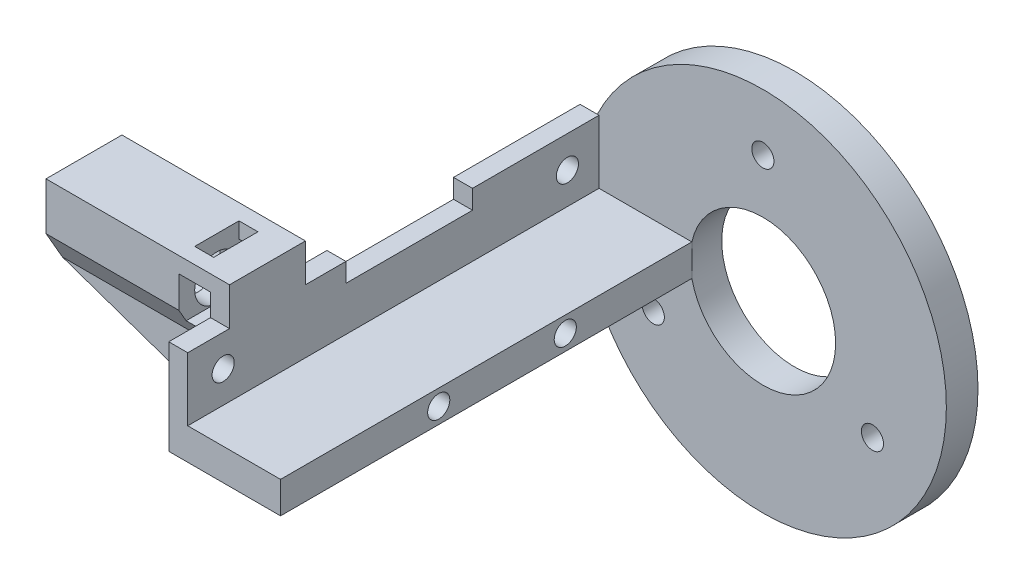
from build123d import *

# Parameters (mm, degrees)
SKETCH_1_R               = 29
EXTRUDE_1_DEPTH          = 5
HOLE_WIZARD_1_D          = 3.5
HOLE_WIZARD_2_D          = 23
EXTRUDE_3_DEPTH          = 65
SKETCH_9_W               = 1
SKETCH_9_H               = 5
CUT_EXTRUDE_1_DEPTH      = 10
SKETCH_10_W              = 3
SKETCH_10_H              = 65
EXTRUDE_5_DEPTH          = 10
HOLE_WIZARD_3_D          = 3.5
CUT_EXTRUDE_2_REACH      = 97.355
SKETCH_16_W              = 20
SKETCH_16_H              = 3
EXTRUDE_START            = -65
EXTRUDE_6_DEPTH          = 65
HOLE_WIZARD_4_D          = 3.5
SKETCH_22_W              = 12
SKETCH_22_H              = 6
EXTRUDE_7_DEPTH          = 3
EXTRUDE_8_DEPTH          = 8
HOLE_WIZARD_5_D          = 7
HOLE_WIZARD_5_DEPTH      = 3
SKETCH_27_W              = 5
SKETCH_27_H              = 3.5
CUT_EXTRUDE_3_DEPTH      = 70.598725899
CUT_EXTRUDE_4_REACH      = 94.289
SKETCH_28_W              = 3
SKETCH_28_H              = 3.5
SKETCH_29_R              = 3.5
EXTRUDE_9_DEPTH          = 18
HOLE_WIZARD_6_D          = 10.4
HOLE_WIZARD_6_DEPTH      = 18
SKETCH_32_W              = 26
SKETCH_32_H              = 5
EXTRUDE_10_DEPTH         = 9
CUT_EXTRUDE_5_REACH      = 88.897
EXTRUDE_11_DEPTH         = 65
CUT_EXTRUDE_6_REACH      = 94.404
CUT_EXTRUDE_6_END_RADIUS = 29


with BuildPart() as part:
    # 草图1 → 凸台-拉伸1 (new body)
    with BuildSketch(Plane.XY):
        Circle(SKETCH_1_R)
    extrude(amount=EXTRUDE_1_DEPTH)

    # 孔1 (through all)
    with Locations(Plane.XY.offset(5)):
        with Locations((0, 20), (-17.320508076, -10), (17.320508076, -10)):
            Hole(HOLE_WIZARD_1_D / 2)

    # 孔2 (through all)
    with Locations(Plane.XY.offset(5)):
        with Locations((0, 0)):
            Hole(HOLE_WIZARD_2_D / 2)

    # 草图7 → 凸台-拉伸3 (add)
    with BuildSketch(Plane.XY.offset(5)):
        with BuildLine():
            Line((-28.892040426, 2.5), (-28.892040426, -2.5))
            Line((-28.892040426, -2.5), (-11.22497216, -2.5))
            ThreePointArc((-11.22497216, -2.5), (-11.5, 0), (-11.22497216, 2.5))
            Line((-11.22497216, 2.5), (-28.892040426, 2.5))
        make_face()
    extrude(amount=EXTRUDE_3_DEPTH)

    # 草图9 → 切除-拉伸1 (cut)
    with BuildSketch(Plane.XY.offset(5)):
        with Locations((-29.392040426, 0)):
            Rectangle(SKETCH_9_W, SKETCH_9_H)
    extrude(amount=-CUT_EXTRUDE_1_DEPTH, mode=Mode.SUBTRACT)

    # 草图10 → 凸台-拉伸5 (add)
    with BuildSketch(Plane(origin=(0, 2.5, 0), x_dir=(1, 0, 0), z_dir=(0, 1, 0))):
        with Locations((-27.392040426, -37.5)):
            Rectangle(SKETCH_10_W, SKETCH_10_H)
    extrude(amount=EXTRUDE_5_DEPTH)

    # 孔3 (through all)
    with Locations(Plane.ZY.offset(28.892040426)):
        with Locations((10, 7.5), (64.4, 7.5)):
            Hole(HOLE_WIZARD_3_D / 2)

    # 草图16 → 切除-拉伸2 (cut, up to next)
    with BuildSketch(Plane.ZY.offset(28.892040426), mode=Mode.PRIVATE) as cut_extrude_2_sk1:
        with Locations((35, 11)):
            Rectangle(SKETCH_16_W, SKETCH_16_H)
    cut_extrude_2_tool1 = extrude(cut_extrude_2_sk1.sketch, amount=-CUT_EXTRUDE_2_REACH, mode=Mode.PRIVATE) & part.part
    add(cut_extrude_2_tool1.solids().sort_by_distance((-28.89204, 11, 35))[0], mode=Mode.SUBTRACT)

    # 草图20 → 凸台-拉伸6 (add)
    with BuildSketch(Plane.XY.offset(70).offset(EXTRUDE_START)):
        with BuildLine():
            Line((-11.22497216, 2.5), (-11.22497216, -2.5))
            ThreePointArc((-11.22497216, -2.5), (-11.5, 0), (-11.22497216, 2.5))
        make_face()
    extrude(amount=EXTRUDE_6_DEPTH)

    # 孔4 (through all)
    with Locations(Plane.ZY.offset(28.892040426)):
        with Locations((25, 0), (45, 0)):
            Hole(HOLE_WIZARD_4_D / 2)

    # 草图22 → 凸台-拉伸7 (add)
    with BuildSketch(Plane.ZY.offset(28.892040426)):
        with Locations((57.4, 15.5)):
            Rectangle(SKETCH_22_W, SKETCH_22_H)
    extrude(amount=-EXTRUDE_7_DEPTH)

    # 草图23 → 凸台-拉伸8 (add)
    with BuildSketch(Plane.ZY.offset(28.892040426)):
        Polygon((51.4, 6.5), (60.801923789, 6.5), (63.4, 11), (63.4, 12.5), (63.4, 18.5), (51.4, 18.5), (51.4, 12.5), align=None)
    extrude(amount=EXTRUDE_8_DEPTH)

    # 孔5
    with Locations(Plane.ZY.offset(36.892040426)):
        with Locations((57.4, 12.5)):
            Hole(HOLE_WIZARD_5_D / 2, depth=HOLE_WIZARD_5_DEPTH)

    # 草图27 → 切除-拉伸3 (cut, through all)
    with BuildSketch(Plane(origin=(0, 0, 51.4), x_dir=(-1, 0, 0), z_dir=(0, 0, -1))):
        with Locations((31.392040426, 14.25)):
            Rectangle(SKETCH_27_W, SKETCH_27_H)
        with Locations((31.392040426, 10.75)):
            Rectangle(SKETCH_27_W, SKETCH_27_H)
    extrude(amount=-CUT_EXTRUDE_3_DEPTH, mode=Mode.SUBTRACT)

    # 草图28 → 切除-拉伸4 (cut, up to next)
    with BuildSketch(Plane(origin=(0, 18.5, 0), x_dir=(1, 0, 0), z_dir=(0, 1, 0)), mode=Mode.PRIVATE) as cut_extrude_4_sk1:
        with Locations((-32.392040426, -59.15)):
            Rectangle(SKETCH_28_W, SKETCH_28_H)
    cut_extrude_4_tool1 = extrude(cut_extrude_4_sk1.sketch, amount=-CUT_EXTRUDE_4_REACH, mode=Mode.PRIVATE) & part.part
    # 草图28 → 切除-拉伸4 (cut, up to next)
    with BuildSketch(Plane(origin=(0, 18.5, 0), x_dir=(1, 0, 0), z_dir=(0, 1, 0)), mode=Mode.PRIVATE) as cut_extrude_4_sk2:
        with Locations((-32.392040426, -55.65)):
            Rectangle(SKETCH_28_W, SKETCH_28_H)
    cut_extrude_4_tool2 = extrude(cut_extrude_4_sk2.sketch, amount=-CUT_EXTRUDE_4_REACH, mode=Mode.PRIVATE) & part.part
    add(cut_extrude_4_tool1.solids().sort_by_distance((-32.39204, 18.5, 59.15))[0], mode=Mode.SUBTRACT)
    add(cut_extrude_4_tool2.solids().sort_by_distance((-32.39204, 18.5, 55.65))[0], mode=Mode.SUBTRACT)

    # 草图29 → 凸台-拉伸9 (add)
    # profile 1 of 2: a face of its own
    with BuildSketch(Plane.ZY.offset(36.892040426)):
        Polygon((60.801923789, 6.5), (63.4, 11), (63.4, 18.5), (51.4, 18.5), (51.4, 6.5), align=None)
        with Locations((57.4, 12.5)):
            Circle(SKETCH_29_R, mode=Mode.SUBTRACT)
    # profile 2 of 2: a face of its own
    with BuildSketch(Plane.ZY.offset(36.892040426)):
        with Locations((57.4, 12.5)):
            Circle(SKETCH_29_R)
    extrude(amount=EXTRUDE_9_DEPTH)

    # 孔6
    with Locations(Plane.ZY.offset(54.892040426)):
        with Locations((57.4, 12.5)):
            Hole(HOLE_WIZARD_6_D / 2, depth=HOLE_WIZARD_6_DEPTH)

    # 草图32 → 凸台-拉伸10 (add)
    with BuildSketch(Plane.XZ.offset(-6.5)):
        with Locations((-41.892040426, 58.301923789)):
            Rectangle(SKETCH_32_W, SKETCH_32_H)
    extrude(amount=EXTRUDE_10_DEPTH)

    # 草图33 → 切除-拉伸5 (cut, up to next)
    with BuildSketch(Plane.XY.offset(60.801923789), mode=Mode.PRIVATE) as cut_extrude_5_sk1:
        Polygon((-54.892040426, 6.5), (-28.892040426, -2.5), (-54.892040426, -2.5), align=None)
    cut_extrude_5_tool1 = extrude(cut_extrude_5_sk1.sketch, amount=-CUT_EXTRUDE_5_REACH, mode=Mode.PRIVATE) & part.part
    add(cut_extrude_5_tool1.solids().sort_by_distance((-46.225374, 0.5, 60.801924))[0], mode=Mode.SUBTRACT)

    # 草图34 → 凸台-拉伸11 (add)
    with BuildSketch(Plane.XY.offset(5)):
        with BuildLine():
            Line((-23.892040426, -16.436861144), (-23.892040426, -2.5))
            Line((-23.892040426, -2.5), (-28.892040426, -2.5))
            ThreePointArc((-28.892040426, -2.5), (-27.296498356, -9.792914658), (-23.892040426, -16.436861144))
        make_face()
    extrude(amount=EXTRUDE_11_DEPTH)

    # 切除-拉伸6: up to this cylinder (the profile starts inside it)
    cut_extrude_6_end = Plane(origin=(0, 0, 45.61427), z_dir=(0, 0, -1)) * Cylinder(CUT_EXTRUDE_6_END_RADIUS, 247.808, mode=Mode.PRIVATE)
    # 草图35 → 切除-拉伸6 (cut, up to the surface)
    with BuildSketch(Plane(origin=(-23.892040426, 0, 0), x_dir=(0, 0, -1), z_dir=(1, 0, 0)), mode=Mode.PRIVATE) as cut_extrude_6_sk1:
        Polygon((-70, -2.5), (-5, -14.436861144), (-5, -16.436861144), (-70, -16.436861144), align=None)
    cut_extrude_6_tool1 = extrude(cut_extrude_6_sk1.sketch, amount=-CUT_EXTRUDE_6_REACH, mode=Mode.PRIVATE) & cut_extrude_6_end
    add(cut_extrude_6_tool1.solids().sort_by_distance((-23.89204, -11.707577, 45.61427))[0], mode=Mode.SUBTRACT)


solid = part.part
